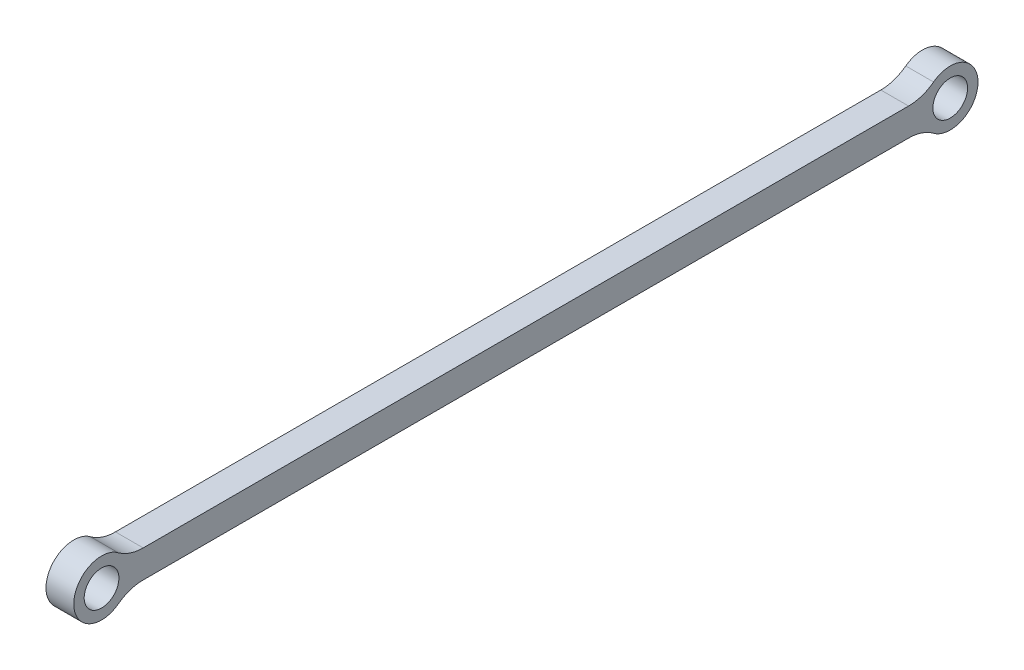
from build123d import *
from build123d.topology import SkipClean

# Parameters (mm, degrees)
SKETCH_1_R          = 5
EXTRUDE_1_DEPTH     = 8
CUT_EXTRUDE_1_DEPTH = 253.753338257
FILLET_1_R          = 12


with BuildPart() as part:
    # 草图1 → 凸台-拉伸1 (new body)
    with BuildSketch(Plane(origin=(0, 0, 0), x_dir=(0, 0, -1), z_dir=(1, 0, 0))):
        with BuildLine():
            Line((0, 8), (244.5, 8))
            ThreePointArc((244.5, 8), (252.5, 0), (244.5, -8))
            Line((244.5, -8), (0, -8))
            ThreePointArc((0, -8), (-8, 0), (0, 8))
        make_face()
        with Locations((244.5, 0)):
            Circle(SKETCH_1_R, mode=Mode.SUBTRACT)
        Circle(SKETCH_1_R, mode=Mode.SUBTRACT)
    extrude(amount=EXTRUDE_1_DEPTH)

    # 草图2 → 切除-拉伸1 (cut, through all)
    with SkipClean():  # the faces are left unmerged after this step: merging them gives an invalid solid
        with BuildSketch(Plane(origin=(8, 0, 0), x_dir=(0, 0, -1), z_dir=(1, 0, 0))):
            with BuildLine():
                Line((237.57179677, -4), (6.92820323, -4))
                ThreePointArc((6.92820323, -4), (4, -6.92820323), (0, -8))
                Line((0, -8), (244.5, -8))
                ThreePointArc((244.5, -8), (240.5, -6.92820323), (237.57179677, -4))
            make_face()
            with BuildLine():
                Line((237.57179677, 4), (6.92820323, 4))
                ThreePointArc((6.92820323, 4), (4, 6.92820323), (0, 8))
                Line((0, 8), (244.5, 8))
                ThreePointArc((244.5, 8), (240.5, 6.92820323), (237.57179677, 4))
            make_face()
        extrude(amount=-CUT_EXTRUDE_1_DEPTH, mode=Mode.SUBTRACT)

    # 圆角1
    fillet_1_edges = [part.edges().sort_by_distance(p)[0] for p in [
        (4, -4, -6.92820323),
        (4, -4, -237.57179677),
        (4, 4, -237.57179677),
        (4, 4, -6.92820323),
    ]]
    fillet(fillet_1_edges, radius=FILLET_1_R)


solid = part.part
